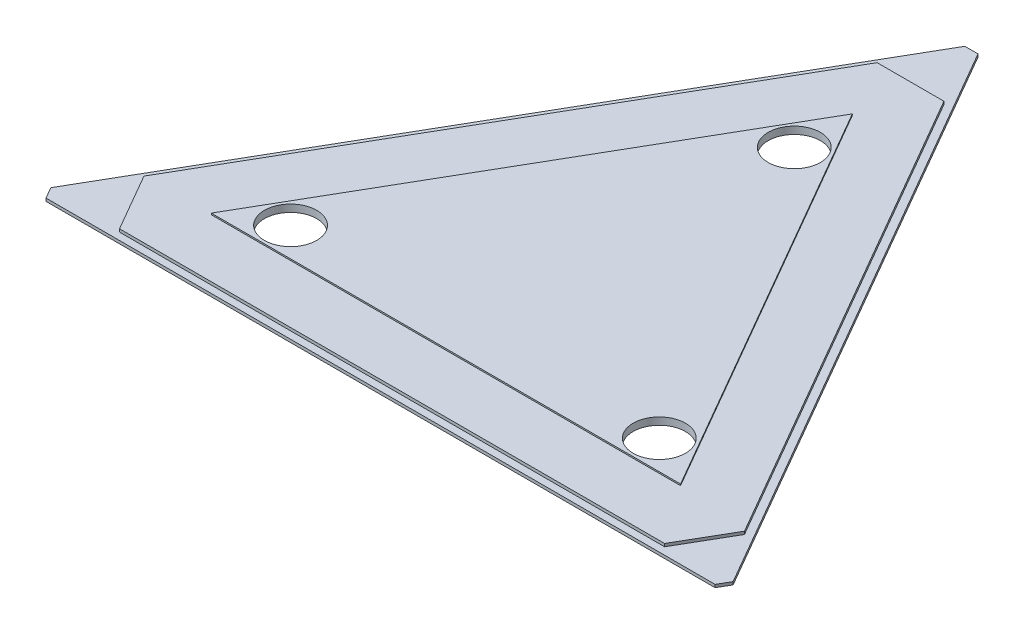
from build123d import *

# Parameters (mm, degrees)
BOSS_EXTRUDE1_DEPTH = 1
BOSS_EXTRUDE2_DEPTH = 2
SKETCH1_13_R        = 9
BOSS_EXTRUDE3_DEPTH = 2.5


with BuildPart() as part:
    # Sketch1 → Boss-Extrude1 (new body)
    with BuildSketch(Plane(origin=(0, 0, 0), x_dir=(1, 0, 0), z_dir=(0, 1, 0))):
        Polygon((229.712705007, -134.986323544), (231.981171214, -138.914415757), (462.517056767, -138.914415757), (464.784783451, -134.986661544), (349.516789508, 64.663360453), (344.980692969, 64.663360453), align=None)
        Polygon((254.809280576, -136.408896139), (243.304219773, -116.484791866), (335.767496284, 43.666038066), (358.778179035, 43.666038066), (452.699916625, -118.984688015), (442.602090749, -136.409305398), align=None, mode=Mode.SUBTRACT)
    extrude(amount=BOSS_EXTRUDE1_DEPTH)

    # Sketch1<12> → Boss-Extrude2 (add)
    with BuildSketch(Plane(origin=(0, 0, 0), x_dir=(1, 0, 0), z_dir=(0, 1, 0))):
        Polygon((335.767496284, 43.666038066), (243.304219773, -116.484791866), (254.809280576, -136.408896139), (442.602090749, -136.409305398), (452.699916625, -118.984688015), (358.778179035, 43.666038066), align=None)
        Polygon((428.113670918, -116.417164681), (266.439108268, -116.428009241), (347.273609729, 23.609230825), align=None, mode=Mode.SUBTRACT)
    extrude(amount=BOSS_EXTRUDE2_DEPTH)

    # Sketch1<13> → Boss-Extrude3 (add)
    with BuildSketch(Plane(origin=(0, 0, 0), x_dir=(1, 0, 0), z_dir=(0, 1, 0))):
        Polygon((347.273609729, 23.609230825), (266.439108268, -116.428009241), (428.113670918, -116.417164681), align=None)
        with Locations((283.758521159, -106.426112565)):
            Circle(SKETCH1_13_R, mode=Mode.SUBTRACT)
        with Locations((410.793152563, -106.417182487)):
            Circle(SKETCH1_13_R, mode=Mode.SUBTRACT)
        with Locations((347.273609729, 3.609230825)):
            Circle(SKETCH1_13_R, mode=Mode.SUBTRACT)
    extrude(amount=BOSS_EXTRUDE3_DEPTH)


solid = part.part
